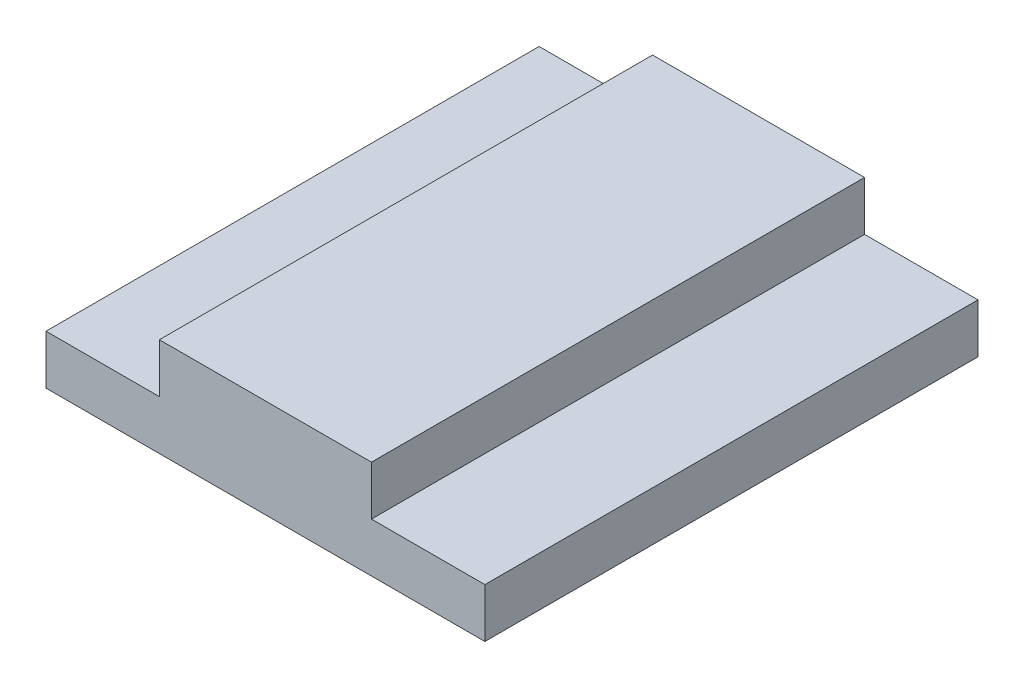
from build123d import *

# Parameters (mm, degrees)
SKETCH_1_W      = 89
SKETCH_1_H      = 100
EXTRUDE_1_DEPTH = 10
EXTRUDE_2_DEPTH = 10


with BuildPart() as part:
    # Эскиз1 → Бобышка-Вытянуть1 (new body)
    with BuildSketch(Plane(origin=(0, 0, 0), x_dir=(1, 0, 0), z_dir=(0, 1, 0))):
        Rectangle(SKETCH_1_W, SKETCH_1_H)
    extrude(amount=EXTRUDE_1_DEPTH)

    # Эскиз2 → Бобышка-Вытянуть2 (add)
    with BuildSketch(Plane(origin=(0, 10, 0), x_dir=(1, 0, 0), z_dir=(0, 1, 0))):
        Polygon((0, 50), (21.5, 50), (21.5, -50), (-21.5, -50), (-21.5, 50), align=None)
    extrude(amount=EXTRUDE_2_DEPTH)


solid = part.part
